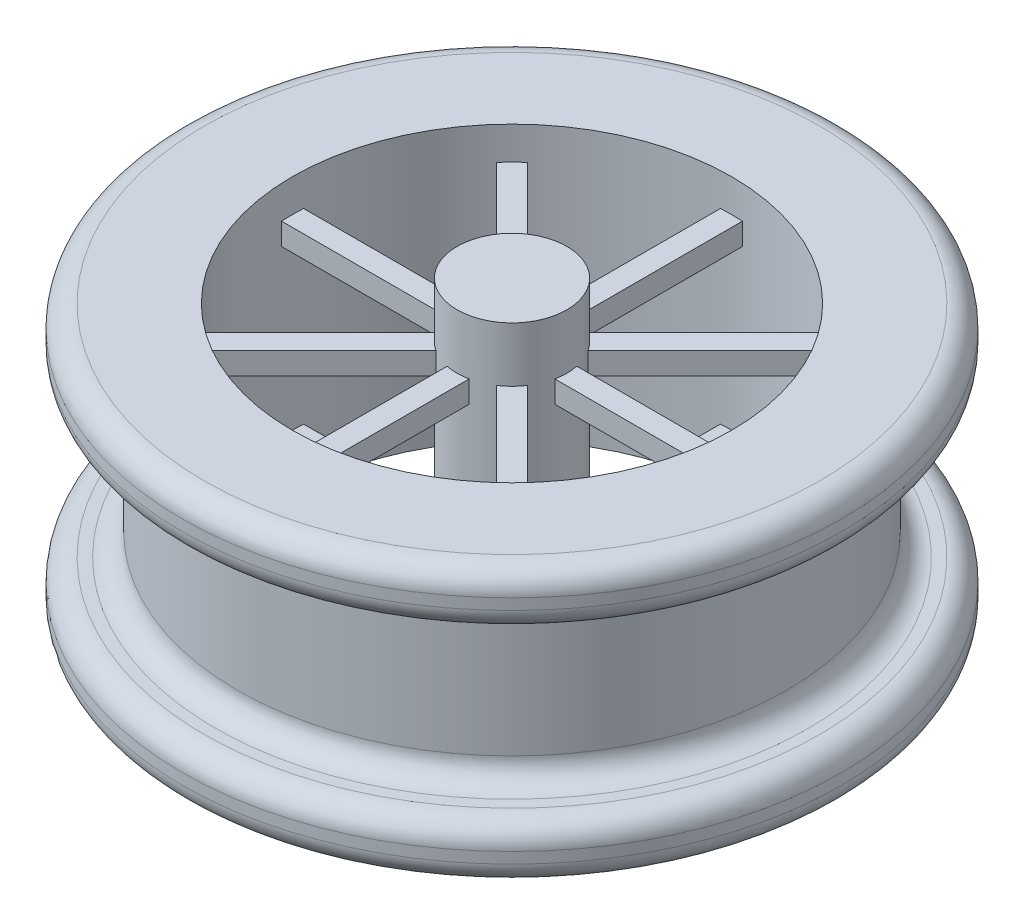
from build123d import *

# Parameters (mm, degrees)
SKETCH1_R               = 63.5
BOSS_EXTRUDE1_DEPTH     = 38.1
SKETCH2_R               = 76.2
BOSS_EXTRUDE2_DEPTH     = 12.7
SKETCH3_R               = 12.7
BOSS_EXTRUDE3_DEPTH     = 5.08
FILLET1_R               = 5.08
SKETCH4_R               = 50.8
SKETCH4_R_2             = 12.7
CUT_EXTRUDE1_DEPTH      = 20.32
SKETCH5_R               = 3.81
BOSS_EXTRUDE4_DEPTH     = 10.16
SKETCH6_W               = 5.08
SKETCH6_H               = 5.08
BOSS_EXTRUDE5_DEPTH     = 50.8
CIRPATTERN1_COUNT       = 8
MIRROR3_COPY_1_SKETCH_W = 5.08
MIRROR3_COPY_1_SKETCH_H = 5.08
MIRROR3_COPY_1_DEPTH    = 50.8
MIRROR3_COPY_2_SKETCH_W = 5.08
MIRROR3_COPY_2_SKETCH_H = 5.08
MIRROR3_COPY_2_DEPTH    = 50.8
MIRROR3_COPY_3_SKETCH_W = 5.08
MIRROR3_COPY_3_SKETCH_H = 5.08
MIRROR3_COPY_3_DEPTH    = 50.8
MIRROR3_COPY_4_SKETCH_W = 5.08
MIRROR3_COPY_4_SKETCH_H = 5.08
MIRROR3_COPY_4_DEPTH    = 50.8
MIRROR3_COPY_5_SKETCH_W = 5.08
MIRROR3_COPY_5_SKETCH_H = 5.08
MIRROR3_COPY_5_DEPTH    = 50.8
MIRROR3_COPY_6_SKETCH_W = 5.08
MIRROR3_COPY_6_SKETCH_H = 5.08
MIRROR3_COPY_6_DEPTH    = 50.8
MIRROR3_COPY_7_SKETCH_W = 5.08
MIRROR3_COPY_7_SKETCH_H = 5.08
MIRROR3_COPY_7_DEPTH    = 50.8
SKETCH7_R               = 50.8
SKETCH7_R_2             = 12.7
CUT_EXTRUDE2_DEPTH      = 22.86


with BuildPart() as part:
    # Sketch1 → Boss-Extrude1 (new body)
    with BuildSketch(Plane(origin=(0, 0, 0), x_dir=(1, 0, 0), z_dir=(0, 1, 0))):
        with Locations(Location((0, 0, 0), (0, 0, 90))):
            Circle(SKETCH1_R)
    extrude(amount=BOSS_EXTRUDE1_DEPTH)

    # Sketch2 → Boss-Extrude2 (add)
    with BuildSketch(Plane(origin=(0, 38.1, 0), x_dir=(1, 0, 0), z_dir=(0, 1, 0))):
        with Locations(Location((0, 0, 0), (0, 0, 270))):
            Circle(SKETCH2_R)
    boss_extrude2 = extrude(amount=BOSS_EXTRUDE2_DEPTH)

    # Sketch3 → Boss-Extrude3 (add)
    with BuildSketch(Plane(origin=(0, 50.8, 0), x_dir=(1, 0, 0), z_dir=(0, 1, 0))):
        with Locations(Location((0, 0, 0), (0, 0, 270))):
            Circle(SKETCH3_R)
    boss_extrude3 = extrude(amount=BOSS_EXTRUDE3_DEPTH)

    # Mirror1: Boss-Extrude2, Boss-Extrude3 across plane
    add(boss_extrude2.mirror(Plane.ZX.offset(19.05)))
    add(boss_extrude3.mirror(Plane.ZX.offset(19.05)))

    # Fillet1
    fillet1_edges = [part.edges().sort_by_distance(p)[0] for p in [
        (0, 0, -76.2),
        (0, 0, 63.5),
        (0, -12.7, -76.2),
        (0, 38.1, 63.5),
        (0, 38.1, -76.2),
        (0, 50.8, -76.2),
    ]]
    fillet(fillet1_edges, radius=FILLET1_R)

    # Sketch4 → Cut-Extrude1 (cut)
    with BuildSketch(Plane.XZ.offset(12.7)):
        with Locations(Location((0, 0, 0), (0, 0, 270))):
            Circle(SKETCH4_R)
        with Locations(Location((0, 0, 0), (0, 0, 90))):
            Circle(SKETCH4_R_2, mode=Mode.SUBTRACT)
    cut_extrude1 = extrude(amount=-CUT_EXTRUDE1_DEPTH, mode=Mode.SUBTRACT)

    # Mirror2: Cut-Extrude1 across plane
    add(cut_extrude1.mirror(Plane(origin=(0, 19.05, 0), x_dir=(0, 0, 1), z_dir=(0, -1, 0))), mode=Mode.SUBTRACT)

    # Sketch5 → Boss-Extrude4 (add)
    with BuildSketch(Plane.XZ.offset(17.78)):
        with Locations(Location((0, 0, 0), (0, 0, 270))):
            Circle(SKETCH5_R)
    extrude(amount=BOSS_EXTRUDE4_DEPTH)

    # Sketch6 → Boss-Extrude5 (add)
    with BuildSketch(Plane(origin=(0, 0, 0), x_dir=(0, 0, -1), z_dir=(1, 0, 0))):
        with Locations((0, 40.64)):
            Rectangle(SKETCH6_W, SKETCH6_H)
    boss_extrude5 = extrude(amount=BOSS_EXTRUDE5_DEPTH)

    # CirPattern1: Boss-Extrude5 ×8 about axis
    cirpattern1_axis = Axis((0, 0, 0), (0, 1, 0))
    for i in range(1, CIRPATTERN1_COUNT):
        add(boss_extrude5.rotate(cirpattern1_axis, i * 360 / CIRPATTERN1_COUNT))

    # Mirror3: Boss-Extrude5 across plane
    add(boss_extrude5.mirror(Plane(origin=(0, 19.05, 0), x_dir=(0, 0, 1), z_dir=(0, -1, 0))))

    # Mirror3 copy 1 sketch → Mirror3 copy 1 (add)
    with BuildSketch(Plane(origin=(0, 38.1, 0), x_dir=(-0.7071067811865475, 0, -0.7071067811865476), z_dir=(0.7071067811865476, 0, -0.7071067811865475))):
        with Locations((0, -40.64)):
            Rectangle(MIRROR3_COPY_1_SKETCH_W, MIRROR3_COPY_1_SKETCH_H)
    extrude(amount=MIRROR3_COPY_1_DEPTH)

    # Mirror3 copy 2 sketch → Mirror3 copy 2 (add)
    with BuildSketch(Plane(origin=(0, 38.1, 0), x_dir=(-1, 0, 0), z_dir=(0, 0, -1))):
        with Locations((0, -40.64)):
            Rectangle(MIRROR3_COPY_2_SKETCH_W, MIRROR3_COPY_2_SKETCH_H)
    extrude(amount=MIRROR3_COPY_2_DEPTH)

    # Mirror3 copy 3 sketch → Mirror3 copy 3 (add)
    with BuildSketch(Plane(origin=(0, 38.1, 0), x_dir=(-0.7071067811865476, 0, 0.7071067811865475), z_dir=(-0.7071067811865475, 0, -0.7071067811865476))):
        with Locations((0, -40.64)):
            Rectangle(MIRROR3_COPY_3_SKETCH_W, MIRROR3_COPY_3_SKETCH_H)
    extrude(amount=MIRROR3_COPY_3_DEPTH)

    # Mirror3 copy 4 sketch → Mirror3 copy 4 (add)
    with BuildSketch(Plane(origin=(0, 38.1, 0), x_dir=(0, 0, 1), z_dir=(-1, 0, 0))):
        with Locations((0, -40.64)):
            Rectangle(MIRROR3_COPY_4_SKETCH_W, MIRROR3_COPY_4_SKETCH_H)
    extrude(amount=MIRROR3_COPY_4_DEPTH)

    # Mirror3 copy 5 sketch → Mirror3 copy 5 (add)
    with BuildSketch(Plane(origin=(0, 38.1, 0), x_dir=(0.7071067811865475, 0, 0.7071067811865477), z_dir=(-0.7071067811865477, 0, 0.7071067811865475))):
        with Locations((0, -40.64)):
            Rectangle(MIRROR3_COPY_5_SKETCH_W, MIRROR3_COPY_5_SKETCH_H)
    extrude(amount=MIRROR3_COPY_5_DEPTH)

    # Mirror3 copy 6 sketch → Mirror3 copy 6 (add)
    with BuildSketch(Plane(origin=(0, 38.1, 0), x_dir=(1, 0, 0), z_dir=(0, 0, 1))):
        with Locations((0, -40.64)):
            Rectangle(MIRROR3_COPY_6_SKETCH_W, MIRROR3_COPY_6_SKETCH_H)
    extrude(amount=MIRROR3_COPY_6_DEPTH)

    # Mirror3 copy 7 sketch → Mirror3 copy 7 (add)
    with BuildSketch(Plane(origin=(0, 38.1, 0), x_dir=(0.7071067811865477, 0, -0.7071067811865474), z_dir=(0.7071067811865474, 0, 0.7071067811865477))):
        with Locations((0, -40.64)):
            Rectangle(MIRROR3_COPY_7_SKETCH_W, MIRROR3_COPY_7_SKETCH_H)
    extrude(amount=MIRROR3_COPY_7_DEPTH)

    # Sketch7 → Cut-Extrude2 (cut)
    with BuildSketch(Plane.XZ.offset(-7.62)):
        with Locations(Location((0, 0, 0), (0, 0, 270))):
            Circle(SKETCH7_R)
        with Locations(Location((0, 0, 0), (0, 0, 90))):
            Circle(SKETCH7_R_2, mode=Mode.SUBTRACT)
    extrude(amount=-CUT_EXTRUDE2_DEPTH, mode=Mode.SUBTRACT)


solid = part.part
